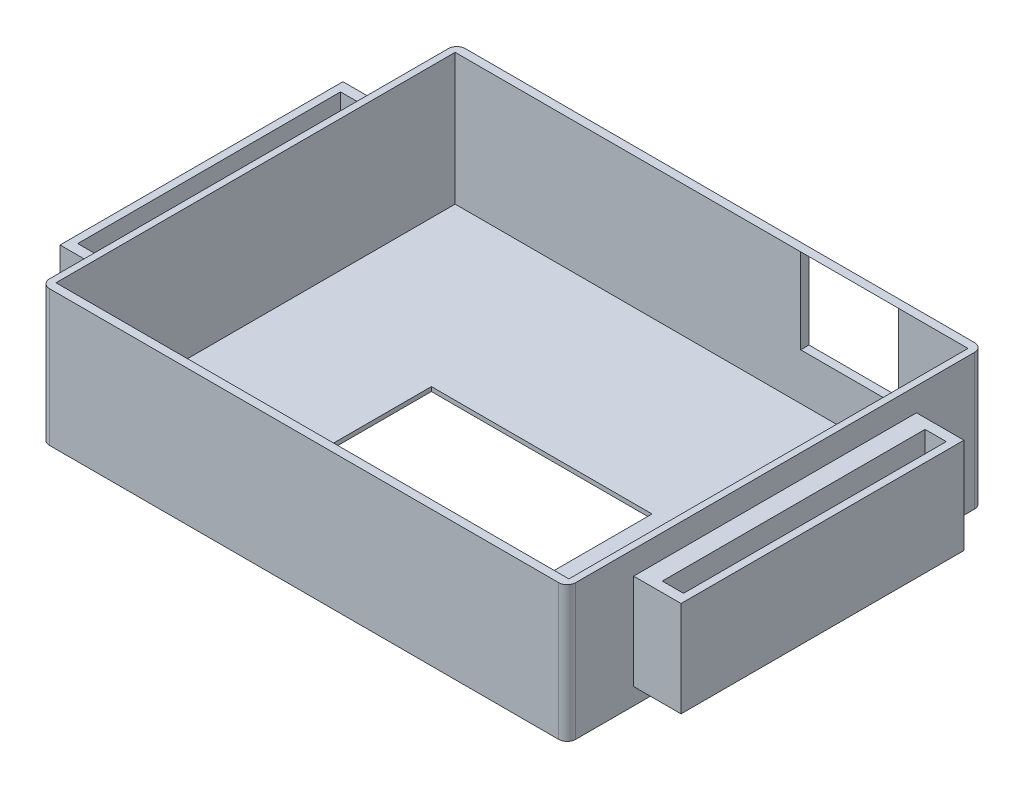
from build123d import *

# Parameters (mm, degrees)
SKETCH2_W           = 62
SKETCH2_H           = 49
BOSS_EXTRUDE2_DEPTH = 16
SKETCH3_W           = 60.436043862
SKETCH3_H           = 47.036060162
CUT_EXTRUDE2_DEPTH  = 15.492
SKETCH4_W           = 26
SKETCH4_H           = 26
CUT_EXTRUDE3_DEPTH  = 1.014
SKETCH6_W           = 11.5
SKETCH6_H           = 10
CUT_EXTRUDE4_DEPTH  = 1.014
FILLET3_R           = 1
SKETCH8_W           = 33.330843918
SKETCH8_H           = 11.266105729
BOSS_EXTRUDE3_DEPTH = 5.586
SKETCH9_W           = 2.5
SKETCH9_H           = 30.963135996
CUT_EXTRUDE5_DEPTH  = 13.714


with BuildPart() as part:
    # Sketch2 → Boss-Extrude2 (new body)
    with BuildSketch(Plane(origin=(0, 0, 0), x_dir=(1, 0, 0), z_dir=(0, 1, 0))):
        Rectangle(SKETCH2_W, SKETCH2_H)
    extrude(amount=BOSS_EXTRUDE2_DEPTH)

    # Sketch3 → Cut-Extrude2 (cut)
    with BuildSketch(Plane(origin=(0, 16, 0), x_dir=(1, 0, 0), z_dir=(0, 1, 0))):
        Rectangle(SKETCH3_W, SKETCH3_H)
    extrude(amount=-CUT_EXTRUDE2_DEPTH, mode=Mode.SUBTRACT)

    # Sketch4 → Cut-Extrude3 (cut)
    with BuildSketch(Plane.XZ):
        with Locations((0, 9.5)):
            Rectangle(SKETCH4_W, SKETCH4_H)
    extrude(amount=-CUT_EXTRUDE3_DEPTH, mode=Mode.SUBTRACT)

    # Sketch6 → Cut-Extrude4 (cut)
    with BuildSketch(Plane(origin=(0, 0, -24.5), x_dir=(-1, 0, 0), z_dir=(0, 0, -1))):
        with Locations((-16.25, 10.9998)):
            Rectangle(SKETCH6_W, SKETCH6_H)
    extrude(amount=-CUT_EXTRUDE4_DEPTH, mode=Mode.SUBTRACT)

    # Fillet3
    fillet3_edges = [part.edges().sort_by_distance(p)[0] for p in [
        (31, 8, 24.5),
        (-31, 8, 24.5),
        (-31, 8, -24.5),
        (31, 8, -24.5),
    ]]
    fillet(fillet3_edges, radius=FILLET3_R)

    # Sketch8 → Boss-Extrude3 (add)
    with BuildSketch(Plane.ZY.offset(31)):
        with Locations((0, 7.613654272)):
            Rectangle(SKETCH8_W, SKETCH8_H)
    boss_extrude3 = extrude(amount=BOSS_EXTRUDE3_DEPTH)

    # Sketch9 → Cut-Extrude5 (cut)
    with BuildSketch(Plane(origin=(0, 13.246707136, 0), x_dir=(1, 0, 0), z_dir=(0, 1, 0))):
        with Locations((-34.442433929, 0)):
            Rectangle(SKETCH9_W, SKETCH9_H)
    cut_extrude5 = extrude(amount=-CUT_EXTRUDE5_DEPTH, mode=Mode.SUBTRACT)

    # Mirror1: Boss-Extrude3, Cut-Extrude5 across plane
    add(boss_extrude3.mirror(Plane(origin=(0, 0, 0), x_dir=(0, 0, 1), z_dir=(1, 0, 0))))
    add(cut_extrude5.mirror(Plane(origin=(0, 0, 0), x_dir=(0, 0, 1), z_dir=(1, 0, 0))), mode=Mode.SUBTRACT)


solid = part.part
